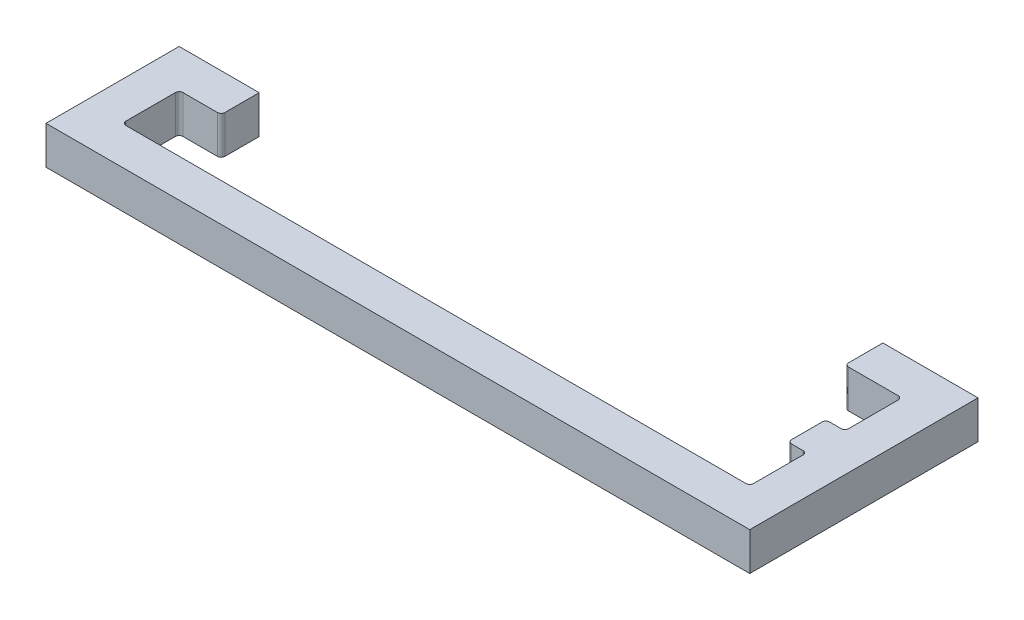
from build123d import *

# Parameters (mm, degrees)
SKETCH1_W           = 5
SKETCH1_H           = 10
BOSS_EXTRUDE1_DEPTH = 10
FILLET3_R           = 1


with BuildPart() as part:
    # Sketch1 → Boss-Extrude1 (new body)
    with BuildSketch(Plane(origin=(0, 0, 0), x_dir=(1, 0, 0), z_dir=(0, 1, 0))):
        Polygon((142.399069508, 0.29194512), (-22.600930492, 0.29194512), (-22.600930492, 15.29194512), (-11.557039121, 15.29194512), (-11.557039121, 25.29194512), (-22.600930492, 25.29194512), (-32.600930492, 25.29194512), (-32.600930492, 12.072059565), (-32.600930492, 0.29194512), (-32.600930492, -9.70805488), (-14.486354187, -9.70805488), (12.890864677, -9.70805488), (152.399069508, -9.70805488), (152.399069508, 7.072059565), (152.399069508, 38.391958761), (152.399069508, 50.29194512), (142.399069508, 50.29194512), (127.399069508, 50.29194512), (127.399069508, 40.29194512), (142.399069508, 40.29194512), (142.399069508, 25.29194512), (142.399069508, 15.29194512), align=None)
        with Locations((139.899069508, 20.29194512)):
            Rectangle(SKETCH1_W, SKETCH1_H)
    extrude(amount=BOSS_EXTRUDE1_DEPTH)

    # Fillet3
    fillet3_edges = [part.edges().sort_by_distance(p)[0] for p in [
        (-11.557039121, 5, -15.29194512),
        (-22.600930492, 5, -15.29194512),
        (-22.600930492, 5, -0.29194512),
        (142.399069508, 5, -0.29194512),
        (142.399069508, 5, -15.29194512),
        (137.399069508, 5, -15.29194512),
        (137.399069508, 5, -25.29194512),
        (142.399069508, 5, -25.29194512),
        (142.399069508, 5, -40.29194512),
        (127.399069508, 5, -40.29194512),
    ]]
    fillet(fillet3_edges, radius=FILLET3_R)


solid = part.part
